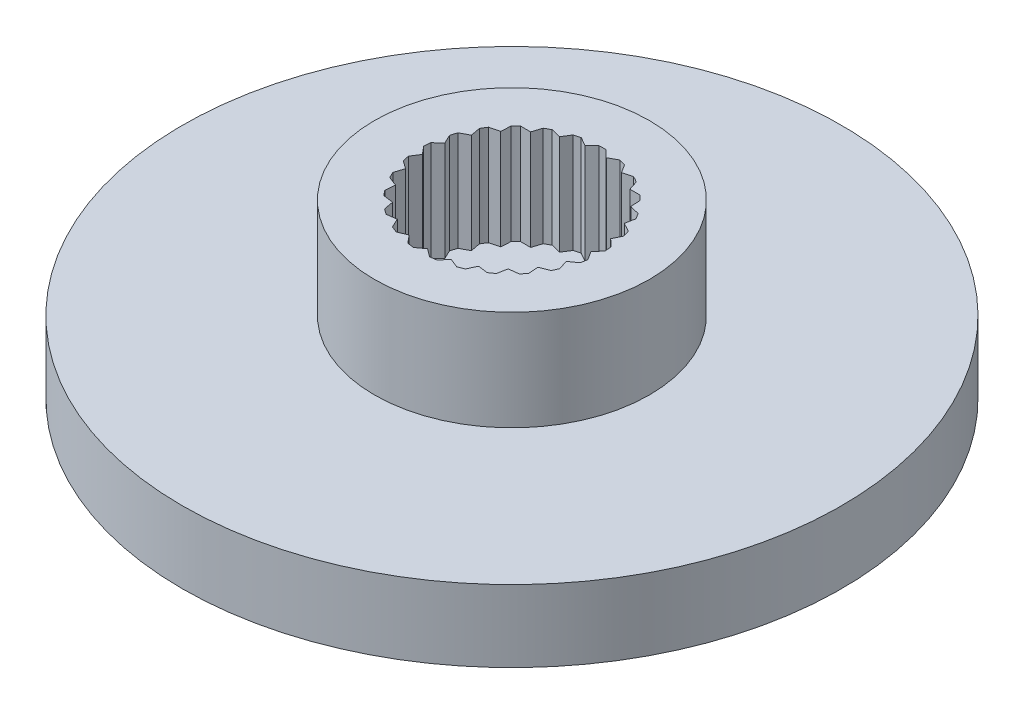
from build123d import *

# Parameters (mm, degrees)
SKETCH2_R           = 6
SKETCH2_R_2         = 1.5
BOSS_EXTRUDE1_DEPTH = 1.15
SKETCH3_R           = 4.4
BOSS_EXTRUDE2_DEPTH = 3.2
SKETCH5_R           = 10.541
SKETCH5_R_2         = 1.5
BOSS_EXTRUDE4_DEPTH = 1.15
CUT_EXTRUDE1_DEPTH  = 1


with BuildPart() as part:
    # Sketch2 → Boss-Extrude1 (new, symmetric)
    with BuildSketch(Plane(origin=(0, 0, 0), x_dir=(1, 0, 0), z_dir=(0, 1, 0))):
        with Locations(Location((0, 0, 0), (0, 0, 270))):
            Circle(SKETCH2_R)
        with Locations(Location((0, 0, 0), (0, 0, 270))):
            Circle(SKETCH2_R_2, mode=Mode.SUBTRACT)
    extrude(amount=BOSS_EXTRUDE1_DEPTH, both=True)

    # Sketch3 → Boss-Extrude2 (add)
    with BuildSketch(Plane(origin=(0, 1.15, 0), x_dir=(1, 0, 0), z_dir=(0, 1, 0))):
        with Locations(Location((0, 0, 0), (0, 0, 270))):
            Circle(SKETCH3_R)
        with BuildLine():
            Line((0.107421435, 2.898009771), (0.338399731, 2.678709694))
            Line((0.338399731, 2.678709694), (0.61665913, 2.83367809))
            ThreePointArc((0.61665913, 2.83367809), (0.721200673, 2.808891167), (0.824752316, 2.780248841))
            Line((0.824752316, 2.780248841), (0.993936292, 2.510396512))
            Line((0.993936292, 2.510396512), (1.301992734, 2.591295993))
            ThreePointArc((1.301992734, 2.591295993), (1.397085655, 2.541289372), (1.490260976, 2.48779465))
            Line((1.490260976, 2.48779465), (1.587020181, 2.184345885))
            Line((1.587020181, 2.184345885), (1.905517346, 2.186093238))
            ThreePointArc((1.905517346, 2.186093238), (1.985186607, 2.11400902), (2.062131058, 2.039023173))
            Line((2.062131058, 2.039023173), (2.080385755, 1.721044772))
            Line((2.080385755, 1.721044772), (2.389311295, 1.643530205))
            ThreePointArc((2.389311295, 1.643530205), (2.448550984, 1.553897705), (2.504429862, 1.46213237))
            Line((2.504429862, 1.46213237), (2.443033042, 1.149604087))
            Line((2.443033042, 1.149604087), (2.722976028, 0.997698125))
            ThreePointArc((2.722976028, 0.997698125), (2.758063897, 0.896149284), (2.789366126, 0.793370413))
            Line((2.789366126, 0.793370413), (2.652175577, 0.505929549))
            Line((2.652175577, 0.505929549), (2.885546163, 0.289177003))
            ThreePointArc((2.885546163, 0.289177003), (2.894277512, 0.182092507), (2.899036259, 0.074758075))
            Line((2.899036259, 0.074758075), (2.694672167, -0.169534403))
            Line((2.694672167, -0.169534403), (2.866806821, -0.437514174))
            ThreePointArc((2.866806821, -0.437514174), (2.848633027, -0.543405812), (2.826549281, -0.648551587))
            Line((2.826549281, -0.648551587), (2.567852594, -0.834345885))
            Line((2.567852594, -0.834345885), (2.667935462, -1.136714727))
            ThreePointArc((2.667935462, -1.136714727), (2.623998452, -1.234759946), (2.576459817, -1.331110368))
            Line((2.576459817, -1.331110368), (2.279685399, -1.446732346))
            Line((2.279685399, -1.446732346), (2.301427906, -1.764491312))
            ThreePointArc((2.301427906, -1.764491312), (2.234488404, -1.84852957), (2.164481907, -1.930030589))
            Line((2.164481907, -1.930030589), (1.848277186, -1.968215294))
            Line((1.848277186, -1.968215294), (1.790313171, -2.281398419))
            ThreePointArc((1.790313171, -2.281398419), (1.704577232, -2.346149284), (1.616501638, -2.40767989))
            Line((1.616501638, -2.40767989), (1.30073492, -2.366028036))
            Line((1.30073492, -2.366028036), (1.166706475, -2.654956874))
            ThreePointArc((1.166706475, -2.654956874), (1.067561203, -2.696351809), (0.966950626, -2.734045809))
            Line((0.966950626, -2.734045809), (0.671462695, -2.615174535))
            Line((0.671462695, -2.615174535), (0.469791321, -2.861694623))
            ThreePointArc((0.469791321, -2.861694623), (0.363466377, -2.877132634), (0.25664255, -2.888621575))
            Line((0.25664255, -2.888621575), (0, -2.7))
            Line((0, -2.7), (-0.25664255, -2.888621575))
            ThreePointArc((-0.25664255, -2.888621575), (-0.363466377, -2.877132634), (-0.469791321, -2.861694623))
            Line((-0.469791321, -2.861694623), (-0.671462695, -2.615174535))
            Line((-0.671462695, -2.615174535), (-0.966950626, -2.734045809))
            ThreePointArc((-0.966950626, -2.734045809), (-1.067561203, -2.696351809), (-1.166706475, -2.654956874))
            Line((-1.166706475, -2.654956874), (-1.30073492, -2.366028036))
            Line((-1.30073492, -2.366028036), (-1.616501638, -2.40767989))
            ThreePointArc((-1.616501638, -2.40767989), (-1.704577232, -2.346149284), (-1.790313171, -2.281398419))
            Line((-1.790313171, -2.281398419), (-1.848277186, -1.968215294))
            Line((-1.848277186, -1.968215294), (-2.164481907, -1.930030589))
            ThreePointArc((-2.164481907, -1.930030589), (-2.234488404, -1.84852957), (-2.301427906, -1.764491312))
            Line((-2.301427906, -1.764491312), (-2.279685399, -1.446732346))
            Line((-2.279685399, -1.446732346), (-2.576459817, -1.331110368))
            ThreePointArc((-2.576459817, -1.331110368), (-2.623998452, -1.234759946), (-2.667935462, -1.136714727))
            Line((-2.667935462, -1.136714727), (-2.567852594, -0.834345885))
            Line((-2.567852594, -0.834345885), (-2.826549281, -0.648551587))
            ThreePointArc((-2.826549281, -0.648551587), (-2.848633027, -0.543405812), (-2.866806821, -0.437514174))
            Line((-2.866806821, -0.437514174), (-2.694672167, -0.169534403))
            Line((-2.694672167, -0.169534403), (-2.899036259, 0.074758075))
            ThreePointArc((-2.899036259, 0.074758075), (-2.894277512, 0.182092507), (-2.885546163, 0.289177003))
            Line((-2.885546163, 0.289177003), (-2.652175577, 0.505929549))
            Line((-2.652175577, 0.505929549), (-2.789366126, 0.793370413))
            ThreePointArc((-2.789366126, 0.793370413), (-2.758063897, 0.896149284), (-2.722976028, 0.997698125))
            Line((-2.722976028, 0.997698125), (-2.443033042, 1.149604087))
            Line((-2.443033042, 1.149604087), (-2.504429862, 1.46213237))
            ThreePointArc((-2.504429862, 1.46213237), (-2.448550984, 1.553897705), (-2.389311295, 1.643530205))
            Line((-2.389311295, 1.643530205), (-2.080385755, 1.721044772))
            Line((-2.080385755, 1.721044772), (-2.062131058, 2.039023173))
            ThreePointArc((-2.062131058, 2.039023173), (-1.985186607, 2.11400902), (-1.905517346, 2.186093238))
            Line((-1.905517346, 2.186093238), (-1.587020181, 2.184345885))
            Line((-1.587020181, 2.184345885), (-1.490260976, 2.48779465))
            ThreePointArc((-1.490260976, 2.48779465), (-1.397085655, 2.541289372), (-1.301992734, 2.591295993))
            Line((-1.301992734, 2.591295993), (-0.993936292, 2.510396512))
            Line((-0.993936292, 2.510396512), (-0.824752316, 2.780248841))
            ThreePointArc((-0.824752316, 2.780248841), (-0.721200673, 2.808891167), (-0.61665913, 2.83367809))
            Line((-0.61665913, 2.83367809), (-0.338399731, 2.678709694))
            Line((-0.338399731, 2.678709694), (-0.107421435, 2.898009771))
            ThreePointArc((-0.107421435, 2.898009771), (0, 2.9), (0.107421435, 2.898009771))
        make_face(mode=Mode.SUBTRACT)
    extrude(amount=BOSS_EXTRUDE2_DEPTH)

    # Sketch5 → Boss-Extrude4 (add, symmetric)
    with BuildSketch(Plane(origin=(0, 0, 0), x_dir=(1, 0, 0), z_dir=(0, 1, 0))):
        with Locations(Location((0, 0, 0), (0, 0, 270))):
            Circle(SKETCH5_R)
        with Locations(Location((0, 0, 0), (0, 0, 270))):
            Circle(SKETCH5_R_2, mode=Mode.SUBTRACT)
    extrude(amount=BOSS_EXTRUDE4_DEPTH, both=True)

    # Sketch8 → Cut-Extrude1 (cut)
    # profile 1 of 15: a face of its own
    with BuildSketch(Plane(origin=(0, -1.15, 0), x_dir=(1, 0, 0), z_dir=(0, 1, 0))):
        with BuildLine():
            ThreePointArc((5.201208047, -5.403465078), (4.886859811, -4.334545567), (4.359829258, -3.352892609))
            ThreePointArc((4.359829258, -3.352892609), (3.64717462, -4.116809115), (2.802926901, -4.732187738))
            ThreePointArc((2.802926901, -4.732187738), (3.713895991, -5.373700834), (4.737131383, -5.814601127))
            ThreePointArc((4.737131383, -5.814601127), (4.973419937, -5.613830611), (5.201208047, -5.403465078))
        make_face()
    # profile 2 of 15: a face of its own
    with BuildSketch(Plane(origin=(0, -1.15, 0), x_dir=(1, 0, 0), z_dir=(0, 1, 0))):
        with BuildLine():
            ThreePointArc((2.094325574, -7.201652615), (2.312735701, -6.109086484), (2.302270198, -4.994952646))
            ThreePointArc((2.302270198, -4.994952646), (1.316236154, -5.340179996), (0.282711218, -5.492729228))
            ThreePointArc((0.282711218, -5.492729228), (0.791208287, -6.484109309), (1.492341648, -7.350028327))
            ThreePointArc((1.492341648, -7.350028327), (1.794867482, -7.282063631), (2.094325574, -7.201652615))
        make_face()
    # profile 3 of 15: a face of its own
    with BuildSketch(Plane(origin=(0, -1.15, 0), x_dir=(1, 0, 0), z_dir=(0, 1, 0))):
        with BuildLine():
            ThreePointArc((-0.282711218, -5.492729228), (-1.316236154, -5.340179996), (-2.302270198, -4.994952646))
            ThreePointArc((-2.302270198, -4.994952646), (-2.312735701, -6.109086484), (-2.094325574, -7.201652615))
            ThreePointArc((-2.094325574, -7.201652615), (-1.794867482, -7.282063631), (-1.492341648, -7.350028327))
            ThreePointArc((-1.492341648, -7.350028327), (-0.791208287, -6.484109309), (-0.282711218, -5.492729228))
        make_face()
    # profile 4 of 15: a face of its own
    with BuildSketch(Plane(origin=(0, -1.15, 0), x_dir=(1, 0, 0), z_dir=(0, 1, 0))):
        with BuildLine():
            ThreePointArc((-2.802926901, -4.732187738), (-3.64717462, -4.116809115), (-4.359829258, -3.352892609))
            ThreePointArc((-4.359829258, -3.352892609), (-4.886859811, -4.334545567), (-5.201208047, -5.403465078))
            ThreePointArc((-5.201208047, -5.403465078), (-4.973419937, -5.613830611), (-4.737131383, -5.814601127))
            ThreePointArc((-4.737131383, -5.814601127), (-3.713895991, -5.373700834), (-2.802926901, -4.732187738))
        make_face()
    # profile 5 of 15: a face of its own
    with BuildSketch(Plane(origin=(0, -1.15, 0), x_dir=(1, 0, 0), z_dir=(0, 1, 0))):
        with BuildLine():
            ThreePointArc((-4.68102581, -2.887559066), (-5.142589335, -1.950326879), (-5.418603976, -0.942725282))
            ThreePointArc((-5.418603976, -0.942725282), (-6.341463231, -1.567012498), (-7.116556437, -2.367408811))
            ThreePointArc((-7.116556437, -2.367408811), (-7.01262182, -2.659536653), (-6.896701407, -2.947118882))
            ThreePointArc((-6.896701407, -2.947118882), (-5.785774881, -3.032242258), (-4.68102581, -2.887559066))
        make_face()
    # profile 6 of 15: a face of its own
    with BuildSketch(Plane(origin=(0, -1.15, 0), x_dir=(1, 0, 0), z_dir=(0, 1, 0))):
        with BuildLine():
            ThreePointArc((-5.486758119, -0.381425412), (-5.459898808, 0.662951741), (-5.236041824, 1.683409046))
            ThreePointArc((-5.236041824, 1.683409046), (-6.343313848, 1.559504249), (-7.401587511, 1.210992284))
            ThreePointArc((-7.401587511, 1.210992284), (-7.445316556, 0.904025102), (-7.476320253, 0.595512782))
            ThreePointArc((-7.476320253, 0.595512782), (-6.532202472, 0.003866477), (-5.486758119, -0.381425412))
        make_face()
    # profile 7 of 15: a face of its own
    with BuildSketch(Plane(origin=(0, -1.15, 0), x_dir=(1, 0, 0), z_dir=(0, 1, 0))):
        with BuildLine():
            ThreePointArc((-5.035540265, 2.212088208), (-4.526411262, 3.124356107), (-3.853965592, 3.923894649))
            ThreePointArc((-3.853965592, 3.923894649), (-4.891987708, 4.328757368), (-5.991004086, 4.511969642))
            ThreePointArc((-5.991004086, 4.511969642), (-6.172378994, 4.2604856), (-6.343204228, 4.001719645))
            ThreePointArc((-6.343204228, 4.001719645), (-5.782181198, 3.039089449), (-5.035540265, 2.212088208))
        make_face()
    # profile 8 of 15: a face of its own
    with BuildSketch(Plane(origin=(0, -1.15, 0), x_dir=(1, 0, 0), z_dir=(0, 1, 0))):
        with BuildLine():
            ThreePointArc((-3.430740821, 4.298839078), (-2.555977446, 4.870008141), (-1.588992288, 5.265463276))
            ThreePointArc((-1.588992288, 5.265463276), (-2.319966139, 6.10634434), (-3.207953823, 6.779309129))
            ThreePointArc((-3.207953823, 6.779309129), (-3.48542379, 6.640920192), (-3.756936559, 6.491180762))
            ThreePointArc((-3.756936559, 6.491180762), (-3.707531894, 5.378093653), (-3.430740821, 4.298839078))
        make_face()
    # profile 9 of 15: a face of its own
    with BuildSketch(Plane(origin=(0, -1.15, 0), x_dir=(1, 0, 0), z_dir=(0, 1, 0))):
        with BuildLine():
            ThreePointArc((7.116556437, -2.367408811), (6.341463231, -1.567012498), (5.418603976, -0.942725282))
            ThreePointArc((5.418603976, -0.942725282), (5.142589335, -1.950326879), (4.68102581, -2.887559066))
            ThreePointArc((4.68102581, -2.887559066), (5.785774881, -3.032242258), (6.896701407, -2.947118882))
            ThreePointArc((6.896701407, -2.947118882), (7.01262182, -2.659536653), (7.116556437, -2.367408811))
        make_face()
    # profile 10 of 15: a face of its own
    with BuildSketch(Plane(origin=(0, -1.15, 0), x_dir=(1, 0, 0), z_dir=(0, 1, 0))):
        with BuildLine():
            ThreePointArc((7.401587511, 1.210992284), (6.343313848, 1.559504249), (5.236041824, 1.683409046))
            ThreePointArc((5.236041824, 1.683409046), (5.433609759, 0.85198884), (5.5, 0))
            ThreePointArc((5.5, 0), (5.496688533, -0.1908276), (5.486758119, -0.381425412))
            ThreePointArc((5.486758119, -0.381425412), (6.532202472, 0.003866477), (7.476320253, 0.595512782))
            ThreePointArc((7.476320253, 0.595512782), (7.445316556, 0.904025102), (7.401587511, 1.210992284))
        make_face()
    # profile 11 of 15: a face of its own
    with BuildSketch(Plane(origin=(0, -1.15, 0), x_dir=(1, 0, 0), z_dir=(0, 1, 0))):
        with BuildLine():
            ThreePointArc((5.991004086, 4.511969642), (4.891987708, 4.328757368), (3.853965592, 3.923894649))
            ThreePointArc((3.853965592, 3.923894649), (4.526411262, 3.124356107), (5.035540265, 2.212088208))
            ThreePointArc((5.035540265, 2.212088208), (5.782181198, 3.039089449), (6.343204228, 4.001719645))
            ThreePointArc((6.343204228, 4.001719645), (6.172378994, 4.2604856), (5.991004086, 4.511969642))
        make_face()
    # profile 12 of 15: a face of its own
    with BuildSketch(Plane(origin=(0, -1.15, 0), x_dir=(1, 0, 0), z_dir=(0, 1, 0))):
        with BuildLine():
            ThreePointArc((3.207953823, 6.779309129), (2.319966139, 6.10634434), (1.588992288, 5.265463276))
            ThreePointArc((1.588992288, 5.265463276), (2.555977446, 4.870008141), (3.430740821, 4.298839078))
            ThreePointArc((3.430740821, 4.298839078), (3.707531894, 5.378093653), (3.756936559, 6.491180762))
            ThreePointArc((3.756936559, 6.491180762), (3.48542379, 6.640920192), (3.207953823, 6.779309129))
        make_face()
    # profile 13 of 15: a face of its own
    with BuildSketch(Plane(origin=(0, -1.15, 0), x_dir=(1, 0, 0), z_dir=(0, 1, 0))):
        with BuildLine():
            ThreePointArc((1.04, 5.400777722), (0.52236124, 5.475138239), (0, 5.5))
            ThreePointArc((0, 5.5), (-0.52236124, 5.475138239), (-1.04, 5.400777722))
            ThreePointArc((-1.04, 5.400777722), (-1.316236154, 5.340179996), (-1.588992288, 5.265463276))
            ThreePointArc((-1.588992288, 5.265463276), (-2.555977446, 4.870008141), (-3.430740821, 4.298839078))
            ThreePointArc((-3.430740821, 4.298839078), (-3.64717462, 4.116809115), (-3.853965592, 3.923894649))
            ThreePointArc((-3.853965592, 3.923894649), (-4.526411262, 3.124356107), (-5.035540265, 2.212088208))
            ThreePointArc((-5.035540265, 2.212088208), (-5.142589335, 1.950326879), (-5.236041824, 1.683409046))
            ThreePointArc((-5.236041824, 1.683409046), (-5.459898808, 0.662951741), (-5.486758119, -0.381425412))
            ThreePointArc((-5.486758119, -0.381425412), (-5.459898808, -0.662951741), (-5.418603976, -0.942725282))
            ThreePointArc((-5.418603976, -0.942725282), (-5.142589335, -1.950326879), (-4.68102581, -2.887559066))
            ThreePointArc((-4.68102581, -2.887559066), (-4.526411262, -3.124356107), (-4.359829258, -3.352892609))
            ThreePointArc((-4.359829258, -3.352892609), (-3.64717462, -4.116809115), (-2.802926901, -4.732187738))
            ThreePointArc((-2.802926901, -4.732187738), (-2.555977446, -4.870008141), (-2.302270198, -4.994952646))
            ThreePointArc((-2.302270198, -4.994952646), (-1.316236154, -5.340179996), (-0.282711218, -5.492729228))
            ThreePointArc((-0.282711218, -5.492729228), (0, -5.5), (0.282711218, -5.492729228))
            ThreePointArc((0.282711218, -5.492729228), (1.316236154, -5.340179996), (2.302270198, -4.994952646))
            ThreePointArc((2.302270198, -4.994952646), (2.555977446, -4.870008141), (2.802926901, -4.732187738))
            ThreePointArc((2.802926901, -4.732187738), (3.64717462, -4.116809115), (4.359829258, -3.352892609))
            ThreePointArc((4.359829258, -3.352892609), (4.526411262, -3.124356107), (4.68102581, -2.887559066))
            ThreePointArc((4.68102581, -2.887559066), (5.142589335, -1.950326879), (5.418603976, -0.942725282))
            ThreePointArc((5.418603976, -0.942725282), (5.459898808, -0.662951741), (5.486758119, -0.381425412))
            ThreePointArc((5.486758119, -0.381425412), (5.496688533, -0.1908276), (5.5, 0))
            ThreePointArc((5.5, 0), (5.433609759, 0.85198884), (5.236041824, 1.683409046))
            ThreePointArc((5.236041824, 1.683409046), (5.142589335, 1.950326879), (5.035540265, 2.212088208))
            ThreePointArc((5.035540265, 2.212088208), (4.526411262, 3.124356107), (3.853965592, 3.923894649))
            ThreePointArc((3.853965592, 3.923894649), (3.64717462, 4.116809115), (3.430740821, 4.298839078))
            ThreePointArc((3.430740821, 4.298839078), (2.555977446, 4.870008141), (1.588992288, 5.265463276))
            ThreePointArc((1.588992288, 5.265463276), (1.316236154, 5.340179996), (1.04, 5.400777722))
        make_face()
        with BuildLine():
            ThreePointArc((1.5, 0), (-1.060660172, -1.060660172), (0, 1.5))
            ThreePointArc((0, 1.5), (1.060660172, 1.060660172), (1.5, 0))
        make_face(mode=Mode.SUBTRACT)
    # profile 14 of 15: a face of its own
    with BuildSketch(Plane(origin=(0, -1.15, 0), x_dir=(1, 0, 0), z_dir=(0, 1, 0))):
        with BuildLine():
            Line((0, 7.5), (0, 5.5))
            ThreePointArc((0, 5.5), (0.52236124, 5.475138239), (1.04, 5.400777722))
            ThreePointArc((1.04, 5.400777722), (0.783531714, 6.485041414), (0.31, 7.493590595))
            ThreePointArc((0.31, 7.493590595), (0.155033126, 7.498397477), (0, 7.5))
        make_face()
    # profile 15 of 15: a face of its own
    with BuildSketch(Plane(origin=(0, -1.15, 0), x_dir=(1, 0, 0), z_dir=(0, 1, 0))):
        with BuildLine():
            ThreePointArc((-1.04, 5.400777722), (-0.52236124, 5.475138239), (0, 5.5))
            Line((0, 5.5), (0, 7.5))
            ThreePointArc((0, 7.5), (-0.155033126, 7.498397477), (-0.31, 7.493590595))
            ThreePointArc((-0.31, 7.493590595), (-0.783531714, 6.485041414), (-1.04, 5.400777722))
        make_face()
    extrude(amount=CUT_EXTRUDE1_DEPTH, mode=Mode.SUBTRACT)


solid = part.part
